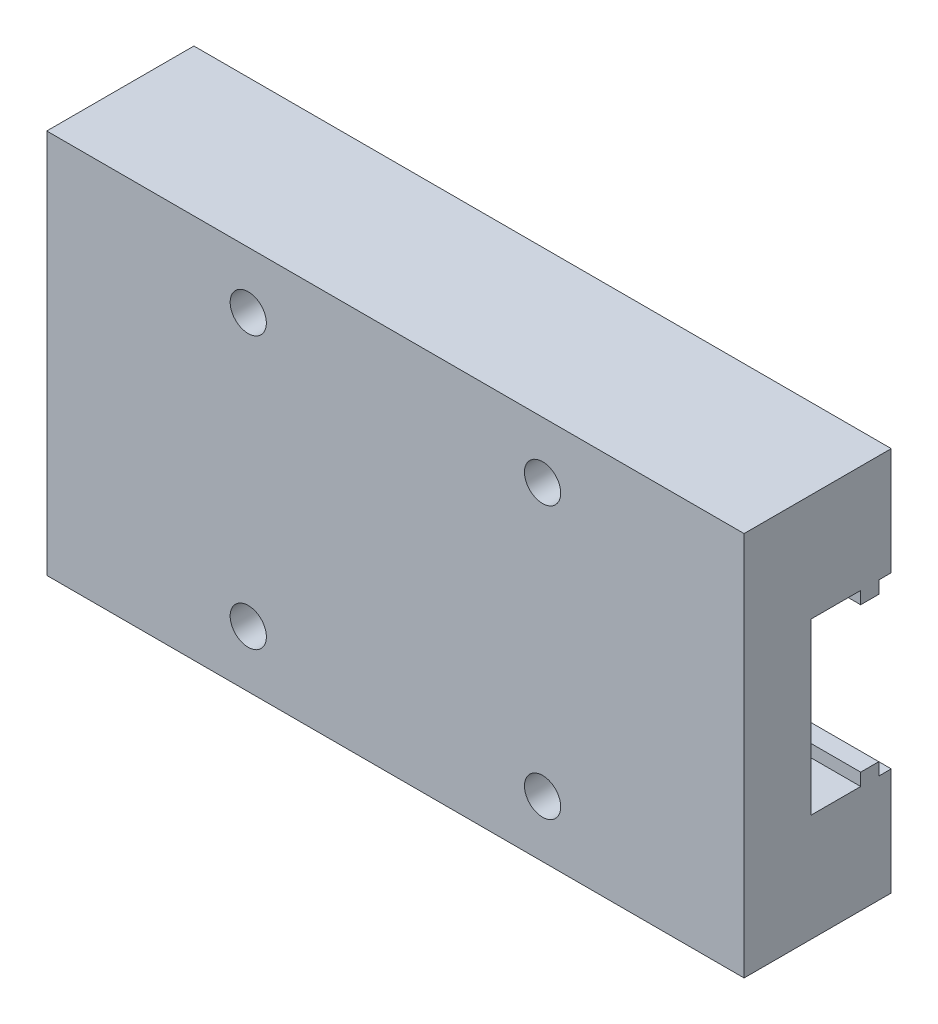
from build123d import *

# Parameters (mm, degrees)
MGN7H_START                                 = 33.9
MGN7H_30_8_X_17_MM_BLOCK_PROFILE_W          = 30.8
MGN7H_30_8_X_17_MM_BLOCK_PROFILE_H          = 17
MGN7H_30_8_X_17_MM_BLOCK_DEPTH              = 6.5
RAIL_START                                  = 33.85
RAIL_SLOT_AND_RUNNING_CLEARANCE_PROFILE_W   = 31
RAIL_SLOT_AND_RUNNING_CLEARANCE_PROFILE_H   = 7.5
RAIL_SLOT_AND_RUNNING_CLEARANCE_DEPTH       = 3.6
NOMINAL_START                               = 34.45
NOMINAL_RACEWAY_SHOULDERS_PROFILE_W         = 30.8
NOMINAL_RACEWAY_SHOULDERS_PROFILE_H         = 0.65
NOMINAL_RACEWAY_SHOULDERS_DEPTH             = 0.8
M2_START                                    = 37.9
M2_X_2_5_BLOCK_HOLES_13_X_12_MM_PITCH_PR_R  = 0.8
M2_X_2_5_BLOCK_HOLES_13_X_12_MM_PITCH_DEPTH = 2.6


with BuildPart() as part:
    # MGN7H 30.8 x 17 mm block profile → MGN7H 30.8 x 17 mm block (new body)
    with BuildSketch(Plane.XY.offset(MGN7H_START)):
        with Locations((8.5, 19)):
            Rectangle(MGN7H_30_8_X_17_MM_BLOCK_PROFILE_W, MGN7H_30_8_X_17_MM_BLOCK_PROFILE_H)
    extrude(amount=MGN7H_30_8_X_17_MM_BLOCK_DEPTH)

    # Rail slot and running clearance profile → Rail slot and running clearance (cut)
    with BuildSketch(Plane.XY.offset(RAIL_START)):
        with Locations((8.5, 19)):
            Rectangle(RAIL_SLOT_AND_RUNNING_CLEARANCE_PROFILE_W, RAIL_SLOT_AND_RUNNING_CLEARANCE_PROFILE_H)
    extrude(amount=RAIL_SLOT_AND_RUNNING_CLEARANCE_DEPTH, mode=Mode.SUBTRACT)

    # Nominal raceway shoulders profile → Nominal raceway shoulders (add)
    with BuildSketch(Plane.XY.offset(NOMINAL_START)):
        with Locations((8.5, 15.475)):
            Rectangle(NOMINAL_RACEWAY_SHOULDERS_PROFILE_W, NOMINAL_RACEWAY_SHOULDERS_PROFILE_H)
        with Locations((8.5, 22.525)):
            Rectangle(NOMINAL_RACEWAY_SHOULDERS_PROFILE_W, NOMINAL_RACEWAY_SHOULDERS_PROFILE_H)
    extrude(amount=NOMINAL_RACEWAY_SHOULDERS_DEPTH)

    # M2 x 2.5 block holes 13 x 12 mm pitch profile → M2 x 2.5 block holes 13 x 12 mm pitch (cut)
    with BuildSketch(Plane.XY.offset(M2_START)):
        with Locations((2, 13)):
            Circle(M2_X_2_5_BLOCK_HOLES_13_X_12_MM_PITCH_PR_R)
        with Locations((2, 25)):
            Circle(M2_X_2_5_BLOCK_HOLES_13_X_12_MM_PITCH_PR_R)
        with Locations((15, 13)):
            Circle(M2_X_2_5_BLOCK_HOLES_13_X_12_MM_PITCH_PR_R)
        with Locations((15, 25)):
            Circle(M2_X_2_5_BLOCK_HOLES_13_X_12_MM_PITCH_PR_R)
    extrude(amount=M2_X_2_5_BLOCK_HOLES_13_X_12_MM_PITCH_DEPTH, mode=Mode.SUBTRACT)


solid = part.part
